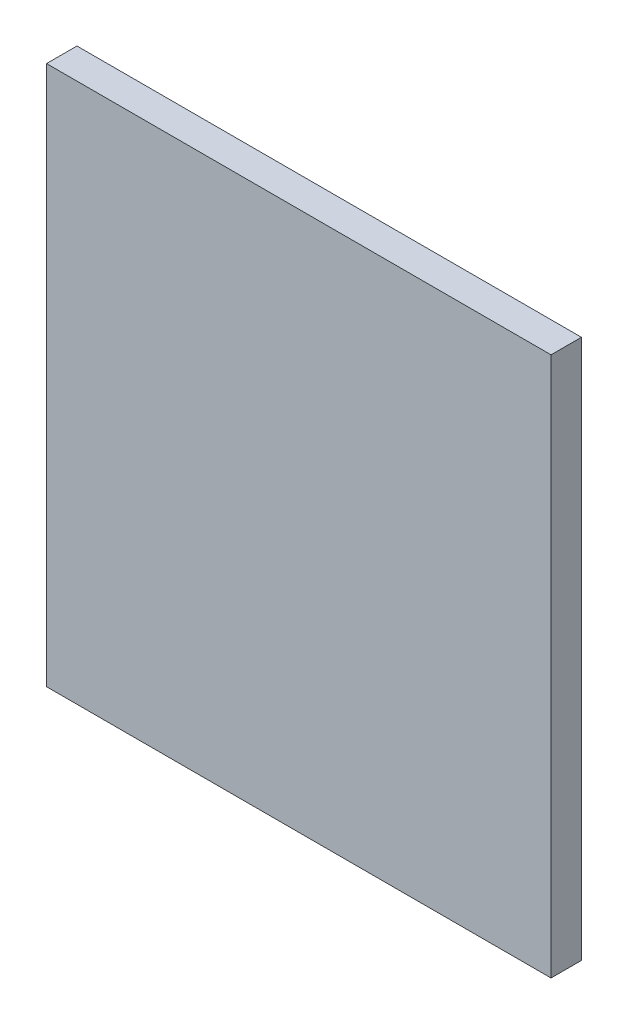
from build123d import *

# Parameters (mm, degrees)
EXTRUDE_1_DEPTH = 1.9


with BuildPart() as part:
    # 草图1 → 凸台-拉伸1 (new body)
    with BuildSketch(Plane.XY):
        Polygon((0, 0), (15.76, 0), (15.76, 33.72), (-15.76, 33.72), (-15.76, 0), align=None)
    extrude(amount=EXTRUDE_1_DEPTH)


solid = part.part
